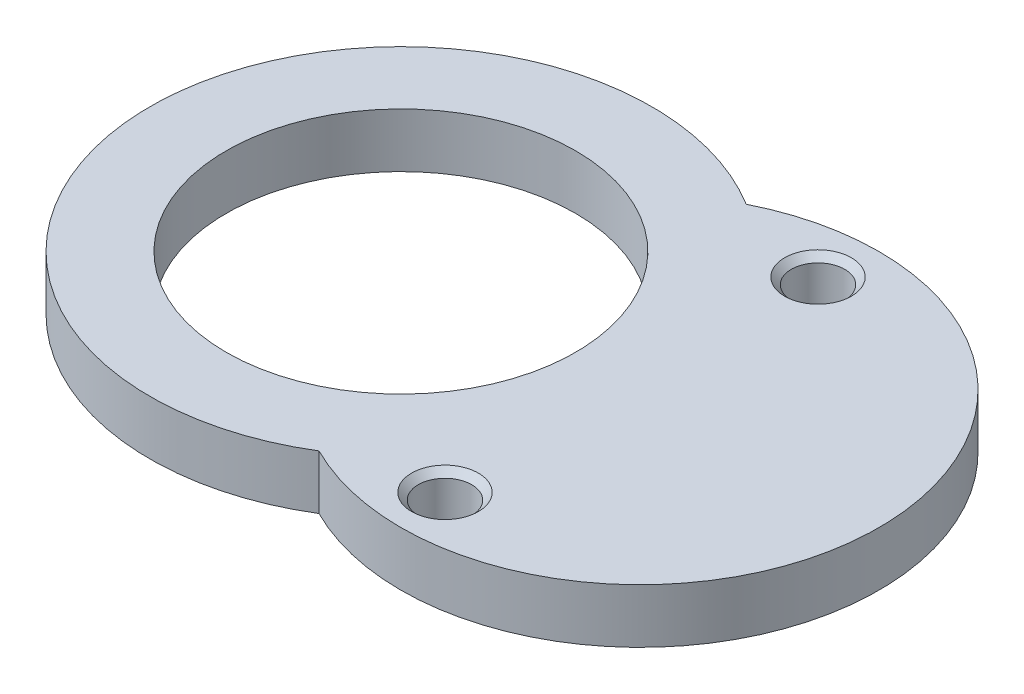
from build123d import *

# Parameters (mm, degrees)
BOSS_EXTRUDE1_DEPTH                             = 2.032
SKETCH2_R                                       = 6.5405
CUT_EXTRUDE1_DEPTH                              = 21.32515872
CSK_FOR_M2_FLAT_HEAD_MACHINE_SCREW1_D           = 2
CSK_FOR_M2_FLAT_HEAD_MACHINE_SCREW1_CSINK_D     = 2.5
CSK_FOR_M2_FLAT_HEAD_MACHINE_SCREW1_CSINK_ANGLE = 90


with BuildPart() as part:
    # Sketch1 → Boss-Extrude1 (new body)
    with BuildSketch(Plane(origin=(0, 0, 0), x_dir=(1, 0, 0), z_dir=(0, 1, 0))):
        with BuildLine():
            ThreePointArc((4.932283688, 7.999686345), (-9.398, 0), (4.932283688, -7.999686345))
            ThreePointArc((4.932283688, -7.999686345), (17.907, 0), (4.932283688, 7.999686345))
        make_face()
    extrude(amount=BOSS_EXTRUDE1_DEPTH)

    # Sketch2 → Cut-Extrude1 (cut, through all)
    with BuildSketch(Plane(origin=(0, 2.032, 0), x_dir=(1, 0, 0), z_dir=(0, 1, 0))):
        with Locations(Location((0, 0, 0), (0, 0, 270))):
            Circle(SKETCH2_R)
    extrude(amount=-CUT_EXTRUDE1_DEPTH, mode=Mode.SUBTRACT)

    # CSK for M2 Flat Head Machine Screw1 (through all)
    with Locations(Plane(origin=(0, 2.032, 0), x_dir=(1, 0, 0), z_dir=(0, 1, 0))):
        with Locations((8.636, 6.985), (8.636, -6.985)):
            CounterSinkHole(CSK_FOR_M2_FLAT_HEAD_MACHINE_SCREW1_D / 2, CSK_FOR_M2_FLAT_HEAD_MACHINE_SCREW1_CSINK_D / 2, counter_sink_angle=CSK_FOR_M2_FLAT_HEAD_MACHINE_SCREW1_CSINK_ANGLE)


solid = part.part
